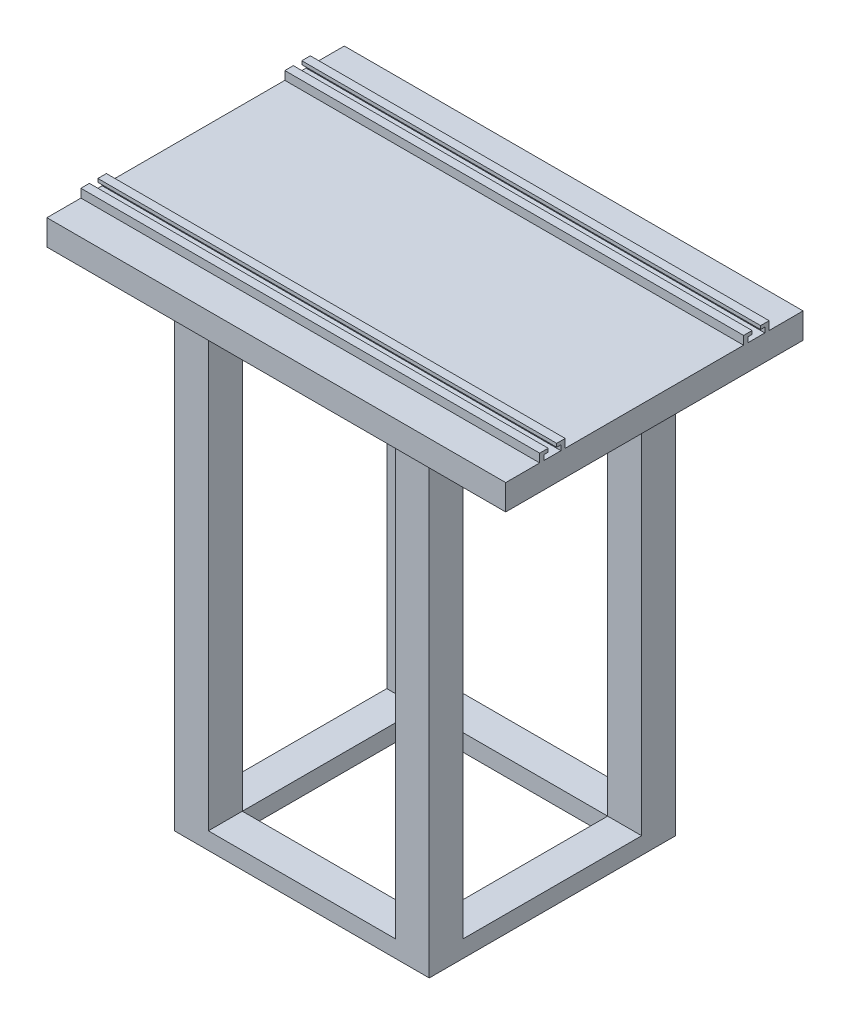
from build123d import *

# Parameters (mm, degrees)
SKETCH_1_W          = 270
SKETCH_1_H          = 175
EXTRUDE_1_DEPTH     = 15
SKETCH_2_W          = 20
SKETCH_2_H          = 20
EXTRUDE_5_DEPTH     = 275
SKETCH_5_W          = 110
SKETCH_5_H          = 20
SKETCH_5_W_2        = 20
SKETCH_5_H_2        = 105
EXTRUDE_6_DEPTH     = 10
SKETCH_6_W          = 110
SKETCH_6_H          = 20
SKETCH_6_W_2        = 20
SKETCH_6_H_2        = 105
EXTRUDE_7_DEPTH     = 10
SKETCH_7_W          = 270
SKETCH_7_H          = 15
EXTRUDE_8_DEPTH     = 5
SKETCH_8_W          = 270
SKETCH_8_H          = 5
CUT_EXTRUDE_1_DEPTH = 2
SKETCH_10_W         = 270
SKETCH_10_H         = 10
CUT_EXTRUDE_2_DEPTH = 3


with BuildPart() as part:
    # 草图1 → 凸台-拉伸1 (new body)
    with BuildSketch(Plane(origin=(0, 0, 0), x_dir=(1, 0, 0), z_dir=(0, 1, 0))):
        Rectangle(SKETCH_1_W, SKETCH_1_H)
    extrude(amount=EXTRUDE_1_DEPTH)

    # 草图2 → 凸台-拉伸5 (add)
    with BuildSketch(Plane.XZ):
        with Locations((-65, -62.5)):
            Rectangle(SKETCH_2_W, SKETCH_2_H)
        with Locations((65, -62.5)):
            Rectangle(SKETCH_2_W, SKETCH_2_H)
        with Locations((-65, 62.5)):
            Rectangle(SKETCH_2_W, SKETCH_2_H)
        with Locations((65, 62.5)):
            Rectangle(SKETCH_2_W, SKETCH_2_H)
    extrude(amount=EXTRUDE_5_DEPTH)

    # 草图5 → 凸台-拉伸6 (add)
    with BuildSketch(Plane.XZ):
        with Locations((0, 62.5)):
            Rectangle(SKETCH_5_W, SKETCH_5_H)
        with Locations((-65, 0)):
            Rectangle(SKETCH_5_W_2, SKETCH_5_H_2)
        with Locations((0, -62.5)):
            Rectangle(SKETCH_5_W, SKETCH_5_H)
        with Locations((65, 0)):
            Rectangle(SKETCH_5_W_2, SKETCH_5_H_2)
    extrude(amount=EXTRUDE_6_DEPTH)

    # 草图6 → 凸台-拉伸7 (add)
    with BuildSketch(Plane(origin=(0, -265, 0), x_dir=(-1, 0, 0), z_dir=(0, -1, 0))):
        with Locations((0, -62.5)):
            Rectangle(SKETCH_6_W, SKETCH_6_H)
        with Locations((65, 0)):
            Rectangle(SKETCH_6_W_2, SKETCH_6_H_2)
        with Locations((-65, 0)):
            Rectangle(SKETCH_6_W_2, SKETCH_6_H_2)
        with Locations((0, 62.5)):
            Rectangle(SKETCH_6_W, SKETCH_6_H)
    extrude(amount=EXTRUDE_7_DEPTH)

    # 草图7 → 凸台-拉伸8 (add)
    with BuildSketch(Plane(origin=(0, 15, 0), x_dir=(1, 0, 0), z_dir=(0, 1, 0))):
        with Locations((0, 60)):
            Rectangle(SKETCH_7_W, SKETCH_7_H)
        with Locations((0, -60)):
            Rectangle(SKETCH_7_W, SKETCH_7_H)
    extrude(amount=EXTRUDE_8_DEPTH)

    # 草图8 → 切除-拉伸1 (cut)
    with BuildSketch(Plane(origin=(0, 20, 0), x_dir=(1, 0, 0), z_dir=(0, 1, 0))):
        with Locations((0, -60)):
            Rectangle(SKETCH_8_W, SKETCH_8_H)
        with Locations((0, 60)):
            Rectangle(SKETCH_8_W, SKETCH_8_H)
    extrude(amount=-CUT_EXTRUDE_1_DEPTH, mode=Mode.SUBTRACT)

    # 草图10 → 切除-拉伸2 (cut)
    with BuildSketch(Plane(origin=(0, 18, 0), x_dir=(1, 0, 0), z_dir=(0, 1, 0))):
        with Locations((0, -60)):
            Rectangle(SKETCH_10_W, SKETCH_10_H)
        with Locations((0, 60)):
            Rectangle(SKETCH_10_W, SKETCH_10_H)
    extrude(amount=-CUT_EXTRUDE_2_DEPTH, mode=Mode.SUBTRACT)


solid = part.part
